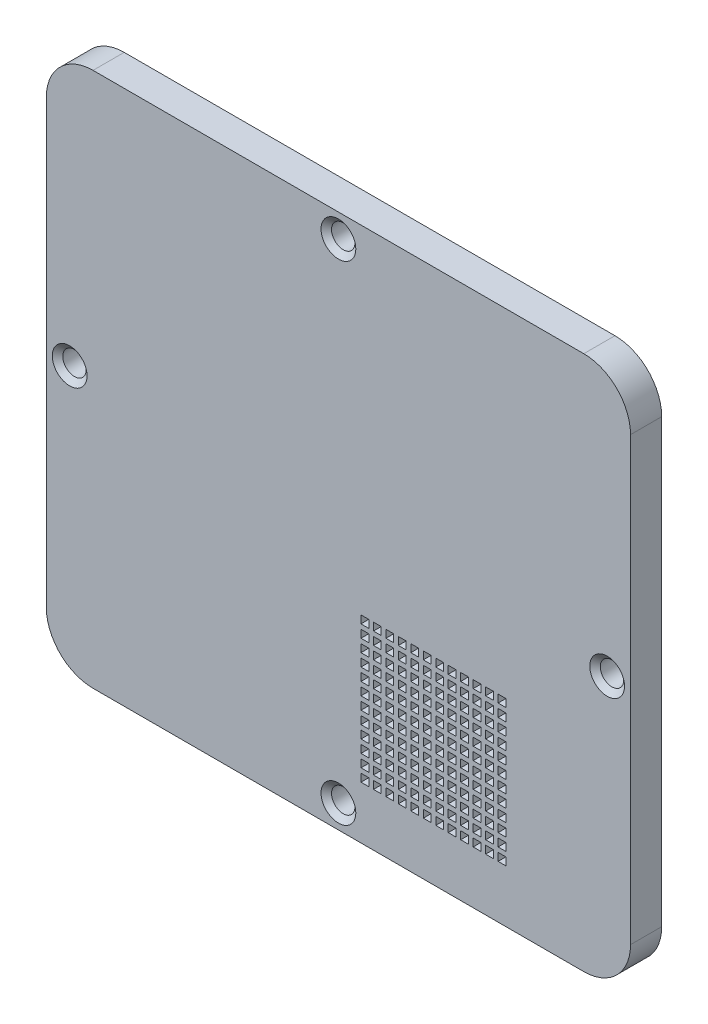
from build123d import *

# Parameters (mm, degrees)
SKETCH2_R                                         = 2.38125
BOSS_EXTRUDE2_DEPTH                               = 6.35
SKETCH5_W                                         = 1.5875
SKETCH5_H                                         = 1.5875
CUT_EXTRUDE4_DEPTH                                = 153.607019808
CSK_FOR_6_FLAT_HEAD_MACHINE_SCREW_100_D           = 3.7973
CSK_FOR_6_FLAT_HEAD_MACHINE_SCREW_100_CSINK_D     = 7.0866
CSK_FOR_6_FLAT_HEAD_MACHINE_SCREW_100_CSINK_ANGLE = 100


with BuildPart() as part:
    # Sketch2 → Boss-Extrude2 (new body)
    with BuildSketch(Plane.XY):
        with BuildLine():
            Line((-6.35, 93.175000086), (-6.35, 3.175))
            ThreePointArc((-6.35, 3.175), (-3.560192091, -3.560192091), (3.175, -6.35))
            Line((3.175, -6.35), (103.174999898, -6.35))
            ThreePointArc((103.174999898, -6.35), (109.910191989, -3.560192091), (112.699999898, 3.175))
            Line((112.699999898, 3.175), (112.699999898, 93.175000086))
            ThreePointArc((112.699999898, 93.175000086), (109.910191989, 99.910192177), (103.174999898, 102.700000086))
            Line((103.174999898, 102.700000086), (3.175, 102.700000086))
            ThreePointArc((3.175, 102.700000086), (-3.560192091, 99.910192177), (-6.35, 93.175000086))
        make_face()
        with Locations((53.174999949, -1.5875)):
            Circle(SKETCH2_R, mode=Mode.SUBTRACT)
        with Locations((107.937499898, 48.175000043)):
            Circle(SKETCH2_R, mode=Mode.SUBTRACT)
        with Locations((53.174999949, 97.937500086)):
            Circle(SKETCH2_R, mode=Mode.SUBTRACT)
        with Locations((-1.5875, 48.175000043)):
            Circle(SKETCH2_R, mode=Mode.SUBTRACT)
    extrude(amount=BOSS_EXTRUDE2_DEPTH)

    # Sketch5 → Cut-Extrude4 (cut, through all)
    with BuildSketch(Plane.XY.offset(6.35)):
        with Locations((86.506249898, 5.173749876)):
            Rectangle(SKETCH5_W, SKETCH5_H)
        with Locations((83.966249898, 5.173749876)):
            Rectangle(SKETCH5_W, SKETCH5_H)
        with Locations((81.426249898, 5.173749876)):
            Rectangle(SKETCH5_W, SKETCH5_H)
        with Locations((78.886249898, 5.173749876)):
            Rectangle(SKETCH5_W, SKETCH5_H)
        with Locations((76.346249898, 5.173749876)):
            Rectangle(SKETCH5_W, SKETCH5_H)
        with Locations((73.806249898, 5.173749876)):
            Rectangle(SKETCH5_W, SKETCH5_H)
        with Locations((71.266249898, 5.173749876)):
            Rectangle(SKETCH5_W, SKETCH5_H)
        with Locations((68.726249898, 5.173749876)):
            Rectangle(SKETCH5_W, SKETCH5_H)
        with Locations((66.186249898, 5.173749876)):
            Rectangle(SKETCH5_W, SKETCH5_H)
        with Locations((63.646249898, 5.173749876)):
            Rectangle(SKETCH5_W, SKETCH5_H)
        with Locations((61.106249898, 5.173749876)):
            Rectangle(SKETCH5_W, SKETCH5_H)
        with Locations((58.566249898, 5.173749876)):
            Rectangle(SKETCH5_W, SKETCH5_H)
        with Locations((83.966249898, 7.713749876)):
            Rectangle(SKETCH5_W, SKETCH5_H)
        with Locations((81.426249898, 7.713749876)):
            Rectangle(SKETCH5_W, SKETCH5_H)
        with Locations((78.886249898, 7.713749876)):
            Rectangle(SKETCH5_W, SKETCH5_H)
        with Locations((76.346249898, 7.713749876)):
            Rectangle(SKETCH5_W, SKETCH5_H)
        with Locations((73.806249898, 7.713749876)):
            Rectangle(SKETCH5_W, SKETCH5_H)
        with Locations((71.266249898, 7.713749876)):
            Rectangle(SKETCH5_W, SKETCH5_H)
        with Locations((68.726249898, 7.713749876)):
            Rectangle(SKETCH5_W, SKETCH5_H)
        with Locations((66.186249898, 7.713749876)):
            Rectangle(SKETCH5_W, SKETCH5_H)
        with Locations((63.646249898, 7.713749876)):
            Rectangle(SKETCH5_W, SKETCH5_H)
        with Locations((61.106249898, 7.713749876)):
            Rectangle(SKETCH5_W, SKETCH5_H)
        with Locations((58.566249898, 7.713749876)):
            Rectangle(SKETCH5_W, SKETCH5_H)
        with Locations((83.966249898, 10.253749876)):
            Rectangle(SKETCH5_W, SKETCH5_H)
        with Locations((81.426249898, 10.253749876)):
            Rectangle(SKETCH5_W, SKETCH5_H)
        with Locations((78.886249898, 10.253749876)):
            Rectangle(SKETCH5_W, SKETCH5_H)
        with Locations((76.346249898, 10.253749876)):
            Rectangle(SKETCH5_W, SKETCH5_H)
        with Locations((73.806249898, 10.253749876)):
            Rectangle(SKETCH5_W, SKETCH5_H)
        with Locations((71.266249898, 10.253749876)):
            Rectangle(SKETCH5_W, SKETCH5_H)
        with Locations((68.726249898, 10.253749876)):
            Rectangle(SKETCH5_W, SKETCH5_H)
        with Locations((66.186249898, 10.253749876)):
            Rectangle(SKETCH5_W, SKETCH5_H)
        with Locations((63.646249898, 10.253749876)):
            Rectangle(SKETCH5_W, SKETCH5_H)
        with Locations((61.106249898, 10.253749876)):
            Rectangle(SKETCH5_W, SKETCH5_H)
        with Locations((58.566249898, 10.253749876)):
            Rectangle(SKETCH5_W, SKETCH5_H)
        with Locations((83.966249898, 12.793749876)):
            Rectangle(SKETCH5_W, SKETCH5_H)
        with Locations((81.426249898, 12.793749876)):
            Rectangle(SKETCH5_W, SKETCH5_H)
        with Locations((78.886249898, 12.793749876)):
            Rectangle(SKETCH5_W, SKETCH5_H)
        with Locations((76.346249898, 12.793749876)):
            Rectangle(SKETCH5_W, SKETCH5_H)
        with Locations((73.806249898, 12.793749876)):
            Rectangle(SKETCH5_W, SKETCH5_H)
        with Locations((71.266249898, 12.793749876)):
            Rectangle(SKETCH5_W, SKETCH5_H)
        with Locations((68.726249898, 12.793749876)):
            Rectangle(SKETCH5_W, SKETCH5_H)
        with Locations((66.186249898, 12.793749876)):
            Rectangle(SKETCH5_W, SKETCH5_H)
        with Locations((63.646249898, 12.793749876)):
            Rectangle(SKETCH5_W, SKETCH5_H)
        with Locations((61.106249898, 12.793749876)):
            Rectangle(SKETCH5_W, SKETCH5_H)
        with Locations((58.566249898, 12.793749876)):
            Rectangle(SKETCH5_W, SKETCH5_H)
        with Locations((83.966249898, 15.333749876)):
            Rectangle(SKETCH5_W, SKETCH5_H)
        with Locations((81.426249898, 15.333749876)):
            Rectangle(SKETCH5_W, SKETCH5_H)
        with Locations((78.886249898, 15.333749876)):
            Rectangle(SKETCH5_W, SKETCH5_H)
        with Locations((76.346249898, 15.333749876)):
            Rectangle(SKETCH5_W, SKETCH5_H)
        with Locations((73.806249898, 15.333749876)):
            Rectangle(SKETCH5_W, SKETCH5_H)
        with Locations((71.266249898, 15.333749876)):
            Rectangle(SKETCH5_W, SKETCH5_H)
        with Locations((68.726249898, 15.333749876)):
            Rectangle(SKETCH5_W, SKETCH5_H)
        with Locations((66.186249898, 15.333749876)):
            Rectangle(SKETCH5_W, SKETCH5_H)
        with Locations((63.646249898, 15.333749876)):
            Rectangle(SKETCH5_W, SKETCH5_H)
        with Locations((61.106249898, 15.333749876)):
            Rectangle(SKETCH5_W, SKETCH5_H)
        with Locations((58.566249898, 15.333749876)):
            Rectangle(SKETCH5_W, SKETCH5_H)
        with Locations((83.966249898, 17.873749876)):
            Rectangle(SKETCH5_W, SKETCH5_H)
        with Locations((81.426249898, 17.873749876)):
            Rectangle(SKETCH5_W, SKETCH5_H)
        with Locations((78.886249898, 17.873749876)):
            Rectangle(SKETCH5_W, SKETCH5_H)
        with Locations((76.346249898, 17.873749876)):
            Rectangle(SKETCH5_W, SKETCH5_H)
        with Locations((73.806249898, 17.873749876)):
            Rectangle(SKETCH5_W, SKETCH5_H)
        with Locations((71.266249898, 17.873749876)):
            Rectangle(SKETCH5_W, SKETCH5_H)
        with Locations((68.726249898, 17.873749876)):
            Rectangle(SKETCH5_W, SKETCH5_H)
        with Locations((66.186249898, 17.873749876)):
            Rectangle(SKETCH5_W, SKETCH5_H)
        with Locations((63.646249898, 17.873749876)):
            Rectangle(SKETCH5_W, SKETCH5_H)
        with Locations((61.106249898, 17.873749876)):
            Rectangle(SKETCH5_W, SKETCH5_H)
        with Locations((58.566249898, 17.873749876)):
            Rectangle(SKETCH5_W, SKETCH5_H)
        with Locations((83.966249898, 20.413749876)):
            Rectangle(SKETCH5_W, SKETCH5_H)
        with Locations((81.426249898, 20.413749876)):
            Rectangle(SKETCH5_W, SKETCH5_H)
        with Locations((78.886249898, 20.413749876)):
            Rectangle(SKETCH5_W, SKETCH5_H)
        with Locations((76.346249898, 20.413749876)):
            Rectangle(SKETCH5_W, SKETCH5_H)
        with Locations((73.806249898, 20.413749876)):
            Rectangle(SKETCH5_W, SKETCH5_H)
        with Locations((71.266249898, 20.413749876)):
            Rectangle(SKETCH5_W, SKETCH5_H)
        with Locations((68.726249898, 20.413749876)):
            Rectangle(SKETCH5_W, SKETCH5_H)
        with Locations((66.186249898, 20.413749876)):
            Rectangle(SKETCH5_W, SKETCH5_H)
        with Locations((63.646249898, 20.413749876)):
            Rectangle(SKETCH5_W, SKETCH5_H)
        with Locations((61.106249898, 20.413749876)):
            Rectangle(SKETCH5_W, SKETCH5_H)
        with Locations((58.566249898, 20.413749876)):
            Rectangle(SKETCH5_W, SKETCH5_H)
        with Locations((83.966249898, 22.953749876)):
            Rectangle(SKETCH5_W, SKETCH5_H)
        with Locations((81.426249898, 22.953749876)):
            Rectangle(SKETCH5_W, SKETCH5_H)
        with Locations((78.886249898, 22.953749876)):
            Rectangle(SKETCH5_W, SKETCH5_H)
        with Locations((76.346249898, 22.953749876)):
            Rectangle(SKETCH5_W, SKETCH5_H)
        with Locations((73.806249898, 22.953749876)):
            Rectangle(SKETCH5_W, SKETCH5_H)
        with Locations((71.266249898, 22.953749876)):
            Rectangle(SKETCH5_W, SKETCH5_H)
        with Locations((68.726249898, 22.953749876)):
            Rectangle(SKETCH5_W, SKETCH5_H)
        with Locations((66.186249898, 22.953749876)):
            Rectangle(SKETCH5_W, SKETCH5_H)
        with Locations((63.646249898, 22.953749876)):
            Rectangle(SKETCH5_W, SKETCH5_H)
        with Locations((61.106249898, 22.953749876)):
            Rectangle(SKETCH5_W, SKETCH5_H)
        with Locations((58.566249898, 22.953749876)):
            Rectangle(SKETCH5_W, SKETCH5_H)
        with Locations((83.966249898, 25.493749876)):
            Rectangle(SKETCH5_W, SKETCH5_H)
        with Locations((81.426249898, 25.493749876)):
            Rectangle(SKETCH5_W, SKETCH5_H)
        with Locations((78.886249898, 25.493749876)):
            Rectangle(SKETCH5_W, SKETCH5_H)
        with Locations((76.346249898, 25.493749876)):
            Rectangle(SKETCH5_W, SKETCH5_H)
        with Locations((73.806249898, 25.493749876)):
            Rectangle(SKETCH5_W, SKETCH5_H)
        with Locations((71.266249898, 25.493749876)):
            Rectangle(SKETCH5_W, SKETCH5_H)
        with Locations((68.726249898, 25.493749876)):
            Rectangle(SKETCH5_W, SKETCH5_H)
        with Locations((66.186249898, 25.493749876)):
            Rectangle(SKETCH5_W, SKETCH5_H)
        with Locations((63.646249898, 25.493749876)):
            Rectangle(SKETCH5_W, SKETCH5_H)
        with Locations((61.106249898, 25.493749876)):
            Rectangle(SKETCH5_W, SKETCH5_H)
        with Locations((58.566249898, 25.493749876)):
            Rectangle(SKETCH5_W, SKETCH5_H)
        with Locations((83.966249898, 28.033749876)):
            Rectangle(SKETCH5_W, SKETCH5_H)
        with Locations((81.426249898, 28.033749876)):
            Rectangle(SKETCH5_W, SKETCH5_H)
        with Locations((78.886249898, 28.033749876)):
            Rectangle(SKETCH5_W, SKETCH5_H)
        with Locations((76.346249898, 28.033749876)):
            Rectangle(SKETCH5_W, SKETCH5_H)
        with Locations((73.806249898, 28.033749876)):
            Rectangle(SKETCH5_W, SKETCH5_H)
        with Locations((71.266249898, 28.033749876)):
            Rectangle(SKETCH5_W, SKETCH5_H)
        with Locations((68.726249898, 28.033749876)):
            Rectangle(SKETCH5_W, SKETCH5_H)
        with Locations((66.186249898, 28.033749876)):
            Rectangle(SKETCH5_W, SKETCH5_H)
        with Locations((63.646249898, 28.033749876)):
            Rectangle(SKETCH5_W, SKETCH5_H)
        with Locations((61.106249898, 28.033749876)):
            Rectangle(SKETCH5_W, SKETCH5_H)
        with Locations((58.566249898, 28.033749876)):
            Rectangle(SKETCH5_W, SKETCH5_H)
        with Locations((83.966249898, 30.573749876)):
            Rectangle(SKETCH5_W, SKETCH5_H)
        with Locations((81.426249898, 30.573749876)):
            Rectangle(SKETCH5_W, SKETCH5_H)
        with Locations((78.886249898, 30.573749876)):
            Rectangle(SKETCH5_W, SKETCH5_H)
        with Locations((76.346249898, 30.573749876)):
            Rectangle(SKETCH5_W, SKETCH5_H)
        with Locations((73.806249898, 30.573749876)):
            Rectangle(SKETCH5_W, SKETCH5_H)
        with Locations((71.266249898, 30.573749876)):
            Rectangle(SKETCH5_W, SKETCH5_H)
        with Locations((68.726249898, 30.573749876)):
            Rectangle(SKETCH5_W, SKETCH5_H)
        with Locations((66.186249898, 30.573749876)):
            Rectangle(SKETCH5_W, SKETCH5_H)
        with Locations((63.646249898, 30.573749876)):
            Rectangle(SKETCH5_W, SKETCH5_H)
        with Locations((61.106249898, 30.573749876)):
            Rectangle(SKETCH5_W, SKETCH5_H)
        with Locations((58.566249898, 30.573749876)):
            Rectangle(SKETCH5_W, SKETCH5_H)
        with Locations((83.966249898, 33.113749876)):
            Rectangle(SKETCH5_W, SKETCH5_H)
        with Locations((81.426249898, 33.113749876)):
            Rectangle(SKETCH5_W, SKETCH5_H)
        with Locations((78.886249898, 33.113749876)):
            Rectangle(SKETCH5_W, SKETCH5_H)
        with Locations((76.346249898, 33.113749876)):
            Rectangle(SKETCH5_W, SKETCH5_H)
        with Locations((73.806249898, 33.113749876)):
            Rectangle(SKETCH5_W, SKETCH5_H)
        with Locations((71.266249898, 33.113749876)):
            Rectangle(SKETCH5_W, SKETCH5_H)
        with Locations((68.726249898, 33.113749876)):
            Rectangle(SKETCH5_W, SKETCH5_H)
        with Locations((66.186249898, 33.113749876)):
            Rectangle(SKETCH5_W, SKETCH5_H)
        with Locations((63.646249898, 33.113749876)):
            Rectangle(SKETCH5_W, SKETCH5_H)
        with Locations((61.106249898, 33.113749876)):
            Rectangle(SKETCH5_W, SKETCH5_H)
        with Locations((58.566249898, 33.113749876)):
            Rectangle(SKETCH5_W, SKETCH5_H)
        with Locations((86.506249898, 7.713749876)):
            Rectangle(SKETCH5_W, SKETCH5_H)
        with Locations((86.506249898, 10.253749876)):
            Rectangle(SKETCH5_W, SKETCH5_H)
        with Locations((86.506249898, 12.793749876)):
            Rectangle(SKETCH5_W, SKETCH5_H)
        with Locations((86.506249898, 15.333749876)):
            Rectangle(SKETCH5_W, SKETCH5_H)
        with Locations((86.506249898, 17.873749876)):
            Rectangle(SKETCH5_W, SKETCH5_H)
        with Locations((86.506249898, 20.413749876)):
            Rectangle(SKETCH5_W, SKETCH5_H)
        with Locations((86.506249898, 22.953749876)):
            Rectangle(SKETCH5_W, SKETCH5_H)
        with Locations((86.506249898, 25.493749876)):
            Rectangle(SKETCH5_W, SKETCH5_H)
        with Locations((86.506249898, 28.033749876)):
            Rectangle(SKETCH5_W, SKETCH5_H)
        with Locations((86.506249898, 30.573749876)):
            Rectangle(SKETCH5_W, SKETCH5_H)
        with Locations((86.506249898, 33.113749876)):
            Rectangle(SKETCH5_W, SKETCH5_H)
    extrude(amount=-CUT_EXTRUDE4_DEPTH, mode=Mode.SUBTRACT)

    # CSK for #6 Flat Head Machine Screw (100)1 (through all)
    with Locations(Plane.XY.offset(6.35)):
        with Locations((-1.5875, 48.175000043), (53.174999949, 97.937500086), (107.937499898, 48.175000043), (53.174999949, -1.5875)):
            CounterSinkHole(CSK_FOR_6_FLAT_HEAD_MACHINE_SCREW_100_D / 2, CSK_FOR_6_FLAT_HEAD_MACHINE_SCREW_100_CSINK_D / 2, counter_sink_angle=CSK_FOR_6_FLAT_HEAD_MACHINE_SCREW_100_CSINK_ANGLE)


solid = part.part
